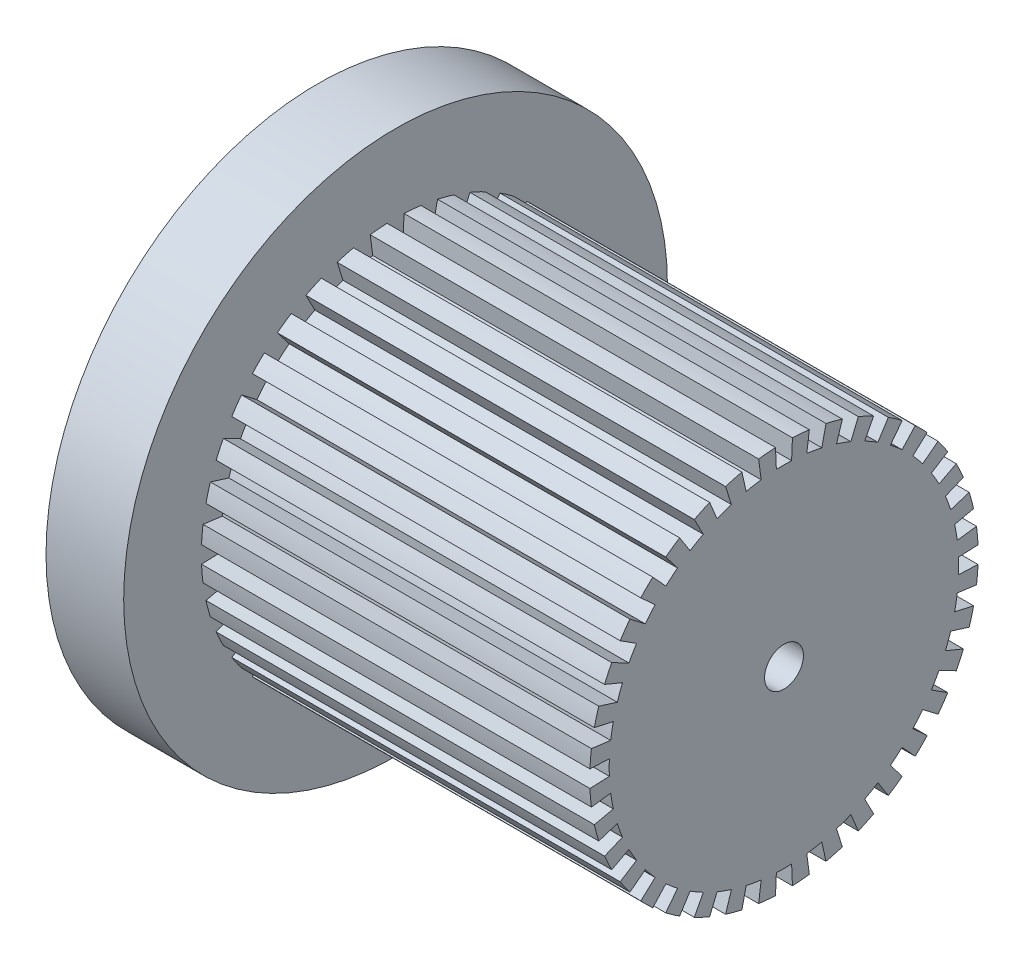
from build123d import *

# Parameters (mm, degrees)
BOSS_EXTRUDE1_DEPTH = 1
SKETCH2_R           = 7
BOSS_EXTRUDE2_DEPTH = 2
BOSS_EXTRUDE3_DEPTH = 10
SKETCH4_R           = 0.5
CUT_EXTRUDE1_DEPTH  = 17.340134638


with BuildPart() as part:
    # Sketch1 → Boss-Extrude1 (new body)
    with BuildSketch(Plane(origin=(0, 0, 0), x_dir=(0, 0, -1), z_dir=(1, 0, 0))):
        with BuildLine():
            Line((0.095962652, 2.197906087), (0.109048468, 2.497620554))
            ThreePointArc((0.109048468, 2.497620554), (0.217889357, 2.490486745), (0.326315481, 2.478612153))
            Line((0.326315481, 2.478612153), (0.287157623, 2.181178695))
            ThreePointArc((0.287157623, 2.181178695), (0.382025991, 2.166577057), (0.476167151, 2.147851216))
            Line((0.476167151, 2.147851216), (0.541099035, 2.440740018))
            ThreePointArc((0.541099035, 2.440740018), (0.647047613, 2.414814566), (0.751764499, 2.384292377))
            Line((0.751764499, 2.384292377), (0.661552759, 2.098177292))
            ThreePointArc((0.661552759, 2.098177292), (0.752444315, 2.067323766), (0.841903551, 2.032534972))
            Line((0.841903551, 2.032534972), (0.956708581, 2.309698831))
            ThreePointArc((0.956708581, 2.309698831), (1.056545654, 2.265769468), (1.154371533, 2.217527083))
            Line((1.154371533, 2.217527083), (1.015846949, 1.951423833))
            ThreePointArc((1.015846949, 1.951423833), (1.1, 1.905255888), (1.182059138, 1.855461181))
            Line((1.182059138, 1.855461181), (1.343249021, 2.108478615))
            ThreePointArc((1.343249021, 2.108478615), (1.433941091, 2.047880111), (1.521903573, 1.983383351))
            Line((1.521903573, 1.983383351), (1.339275144, 1.745377349))
            ThreePointArc((1.339275144, 1.745377349), (1.414132741, 1.685297775), (1.486298457, 1.622010141))
            Line((1.486298457, 1.622010141), (1.688975519, 1.843193342))
            ThreePointArc((1.688975519, 1.843193342), (1.767766953, 1.767766953), (1.843193342, 1.688975519))
            Line((1.843193342, 1.688975519), (1.622010141, 1.486298457))
            ThreePointArc((1.622010141, 1.486298457), (1.685297775, 1.414132741), (1.745377349, 1.339275144))
            Line((1.745377349, 1.339275144), (1.983383351, 1.521903573))
            ThreePointArc((1.983383351, 1.521903573), (2.047880111, 1.433941091), (2.108478615, 1.343249021))
            Line((2.108478615, 1.343249021), (1.855461181, 1.182059138))
            ThreePointArc((1.855461181, 1.182059138), (1.905255888, 1.1), (1.951423833, 1.015846949))
            Line((1.951423833, 1.015846949), (2.217527083, 1.154371533))
            ThreePointArc((2.217527083, 1.154371533), (2.265769468, 1.056545654), (2.309698831, 0.956708581))
            Line((2.309698831, 0.956708581), (2.032534972, 0.841903551))
            ThreePointArc((2.032534972, 0.841903551), (2.067323766, 0.752444315), (2.098177292, 0.661552759))
            Line((2.098177292, 0.661552759), (2.384292377, 0.751764499))
            ThreePointArc((2.384292377, 0.751764499), (2.414814566, 0.647047613), (2.440740018, 0.541099035))
            Line((2.440740018, 0.541099035), (2.147851216, 0.476167151))
            ThreePointArc((2.147851216, 0.476167151), (2.166577057, 0.382025991), (2.181178695, 0.287157623))
            Line((2.181178695, 0.287157623), (2.478612153, 0.326315481))
            ThreePointArc((2.478612153, 0.326315481), (2.490486745, 0.217889357), (2.497620554, 0.109048468))
            Line((2.497620554, 0.109048468), (2.197906087, 0.095962652))
            ThreePointArc((2.197906087, 0.095962652), (2.2, 0), (2.197906087, -0.095962652))
            Line((2.197906087, -0.095962652), (2.497620554, -0.109048468))
            ThreePointArc((2.497620554, -0.109048468), (2.490486745, -0.217889357), (2.478612153, -0.326315481))
            Line((2.478612153, -0.326315481), (2.181178695, -0.287157623))
            ThreePointArc((2.181178695, -0.287157623), (2.166577057, -0.382025991), (2.147851216, -0.476167151))
            Line((2.147851216, -0.476167151), (2.440740018, -0.541099035))
            ThreePointArc((2.440740018, -0.541099035), (2.414814566, -0.647047613), (2.384292377, -0.751764499))
            Line((2.384292377, -0.751764499), (2.098177292, -0.661552759))
            ThreePointArc((2.098177292, -0.661552759), (2.067323766, -0.752444315), (2.032534972, -0.841903551))
            Line((2.032534972, -0.841903551), (2.309698831, -0.956708581))
            ThreePointArc((2.309698831, -0.956708581), (2.265769468, -1.056545654), (2.217527083, -1.154371533))
            Line((2.217527083, -1.154371533), (1.951423833, -1.015846949))
            ThreePointArc((1.951423833, -1.015846949), (1.905255888, -1.1), (1.855461181, -1.182059138))
            Line((1.855461181, -1.182059138), (2.108478615, -1.343249021))
            ThreePointArc((2.108478615, -1.343249021), (2.047880111, -1.433941091), (1.983383351, -1.521903573))
            Line((1.983383351, -1.521903573), (1.745377349, -1.339275144))
            ThreePointArc((1.745377349, -1.339275144), (1.685297775, -1.414132741), (1.622010141, -1.486298457))
            Line((1.622010141, -1.486298457), (1.843193342, -1.688975519))
            ThreePointArc((1.843193342, -1.688975519), (1.767766953, -1.767766953), (1.688975519, -1.843193342))
            Line((1.688975519, -1.843193342), (1.486298457, -1.622010141))
            ThreePointArc((1.486298457, -1.622010141), (1.414132741, -1.685297775), (1.339275144, -1.745377349))
            Line((1.339275144, -1.745377349), (1.521903573, -1.983383351))
            ThreePointArc((1.521903573, -1.983383351), (1.433941091, -2.047880111), (1.343249021, -2.108478615))
            Line((1.343249021, -2.108478615), (1.182059138, -1.855461181))
            ThreePointArc((1.182059138, -1.855461181), (1.1, -1.905255888), (1.015846949, -1.951423833))
            Line((1.015846949, -1.951423833), (1.154371533, -2.217527083))
            ThreePointArc((1.154371533, -2.217527083), (1.056545654, -2.265769468), (0.956708581, -2.309698831))
            Line((0.956708581, -2.309698831), (0.841903551, -2.032534972))
            ThreePointArc((0.841903551, -2.032534972), (0.752444315, -2.067323766), (0.661552759, -2.098177292))
            Line((0.661552759, -2.098177292), (0.751764499, -2.384292377))
            ThreePointArc((0.751764499, -2.384292377), (0.647047613, -2.414814566), (0.541099035, -2.440740018))
            Line((0.541099035, -2.440740018), (0.476167151, -2.147851216))
            ThreePointArc((0.476167151, -2.147851216), (0.382025991, -2.166577057), (0.287157623, -2.181178695))
            Line((0.287157623, -2.181178695), (0.326315481, -2.478612153))
            ThreePointArc((0.326315481, -2.478612153), (0.217889357, -2.490486745), (0.109048468, -2.497620554))
            Line((0.109048468, -2.497620554), (0.095962652, -2.197906087))
            ThreePointArc((0.095962652, -2.197906087), (0, -2.2), (-0.095962652, -2.197906087))
            Line((-0.095962652, -2.197906087), (-0.109048468, -2.497620554))
            ThreePointArc((-0.109048468, -2.497620554), (-0.217889357, -2.490486745), (-0.326315481, -2.478612153))
            Line((-0.326315481, -2.478612153), (-0.287157623, -2.181178695))
            ThreePointArc((-0.287157623, -2.181178695), (-0.382025991, -2.166577057), (-0.476167151, -2.147851216))
            Line((-0.476167151, -2.147851216), (-0.541099035, -2.440740018))
            ThreePointArc((-0.541099035, -2.440740018), (-0.647047613, -2.414814566), (-0.751764499, -2.384292377))
            Line((-0.751764499, -2.384292377), (-0.661552759, -2.098177292))
            ThreePointArc((-0.661552759, -2.098177292), (-0.752444315, -2.067323766), (-0.841903551, -2.032534972))
            Line((-0.841903551, -2.032534972), (-0.956708581, -2.309698831))
            ThreePointArc((-0.956708581, -2.309698831), (-1.056545654, -2.265769468), (-1.154371533, -2.217527083))
            Line((-1.154371533, -2.217527083), (-1.015846949, -1.951423833))
            ThreePointArc((-1.015846949, -1.951423833), (-1.1, -1.905255888), (-1.182059138, -1.855461181))
            Line((-1.182059138, -1.855461181), (-1.343249021, -2.108478615))
            ThreePointArc((-1.343249021, -2.108478615), (-1.433941091, -2.047880111), (-1.521903573, -1.983383351))
            Line((-1.521903573, -1.983383351), (-1.339275144, -1.745377349))
            ThreePointArc((-1.339275144, -1.745377349), (-1.414132741, -1.685297775), (-1.486298457, -1.622010141))
            Line((-1.486298457, -1.622010141), (-1.688975519, -1.843193342))
            ThreePointArc((-1.688975519, -1.843193342), (-1.767766953, -1.767766953), (-1.843193342, -1.688975519))
            Line((-1.843193342, -1.688975519), (-1.622010141, -1.486298457))
            ThreePointArc((-1.622010141, -1.486298457), (-1.685297775, -1.414132741), (-1.745377349, -1.339275144))
            Line((-1.745377349, -1.339275144), (-1.983383351, -1.521903573))
            ThreePointArc((-1.983383351, -1.521903573), (-2.047880111, -1.433941091), (-2.108478615, -1.343249021))
            Line((-2.108478615, -1.343249021), (-1.855461181, -1.182059138))
            ThreePointArc((-1.855461181, -1.182059138), (-1.905255888, -1.1), (-1.951423833, -1.015846949))
            Line((-1.951423833, -1.015846949), (-2.217527083, -1.154371533))
            ThreePointArc((-2.217527083, -1.154371533), (-2.265769468, -1.056545654), (-2.309698831, -0.956708581))
            Line((-2.309698831, -0.956708581), (-2.032534972, -0.841903551))
            ThreePointArc((-2.032534972, -0.841903551), (-2.067323766, -0.752444315), (-2.098177292, -0.661552759))
            Line((-2.098177292, -0.661552759), (-2.384292377, -0.751764499))
            ThreePointArc((-2.384292377, -0.751764499), (-2.414814566, -0.647047613), (-2.440740018, -0.541099035))
            Line((-2.440740018, -0.541099035), (-2.147851216, -0.476167151))
            ThreePointArc((-2.147851216, -0.476167151), (-2.166577057, -0.382025991), (-2.181178695, -0.287157623))
            Line((-2.181178695, -0.287157623), (-2.478612153, -0.326315481))
            ThreePointArc((-2.478612153, -0.326315481), (-2.490486745, -0.217889357), (-2.497620554, -0.109048468))
            Line((-2.497620554, -0.109048468), (-2.197906087, -0.095962652))
            ThreePointArc((-2.197906087, -0.095962652), (-2.2, 0), (-2.197906087, 0.095962652))
            Line((-2.197906087, 0.095962652), (-2.497620554, 0.109048468))
            ThreePointArc((-2.497620554, 0.109048468), (-2.490486745, 0.217889357), (-2.478612153, 0.326315481))
            Line((-2.478612153, 0.326315481), (-2.181178695, 0.287157623))
            ThreePointArc((-2.181178695, 0.287157623), (-2.166577057, 0.382025991), (-2.147851216, 0.476167151))
            Line((-2.147851216, 0.476167151), (-2.440740018, 0.541099035))
            ThreePointArc((-2.440740018, 0.541099035), (-2.414814566, 0.647047613), (-2.384292377, 0.751764499))
            Line((-2.384292377, 0.751764499), (-2.098177292, 0.661552759))
            ThreePointArc((-2.098177292, 0.661552759), (-2.067323766, 0.752444315), (-2.032534972, 0.841903551))
            Line((-2.032534972, 0.841903551), (-2.309698831, 0.956708581))
            ThreePointArc((-2.309698831, 0.956708581), (-2.265769468, 1.056545654), (-2.217527083, 1.154371533))
            Line((-2.217527083, 1.154371533), (-1.951423833, 1.015846949))
            ThreePointArc((-1.951423833, 1.015846949), (-1.905255888, 1.1), (-1.855461181, 1.182059138))
            Line((-1.855461181, 1.182059138), (-2.108478615, 1.343249021))
            ThreePointArc((-2.108478615, 1.343249021), (-2.047880111, 1.433941091), (-1.983383351, 1.521903573))
            Line((-1.983383351, 1.521903573), (-1.745377349, 1.339275144))
            ThreePointArc((-1.745377349, 1.339275144), (-1.685297775, 1.414132741), (-1.622010141, 1.486298457))
            Line((-1.622010141, 1.486298457), (-1.843193342, 1.688975519))
            ThreePointArc((-1.843193342, 1.688975519), (-1.767766953, 1.767766953), (-1.688975519, 1.843193342))
            Line((-1.688975519, 1.843193342), (-1.486298457, 1.622010141))
            ThreePointArc((-1.486298457, 1.622010141), (-1.414132741, 1.685297775), (-1.339275144, 1.745377349))
            Line((-1.339275144, 1.745377349), (-1.521903573, 1.983383351))
            ThreePointArc((-1.521903573, 1.983383351), (-1.433941091, 2.047880111), (-1.343249021, 2.108478615))
            Line((-1.343249021, 2.108478615), (-1.182059138, 1.855461181))
            ThreePointArc((-1.182059138, 1.855461181), (-1.1, 1.905255888), (-1.015846949, 1.951423833))
            Line((-1.015846949, 1.951423833), (-1.154371533, 2.217527083))
            ThreePointArc((-1.154371533, 2.217527083), (-1.056545654, 2.265769468), (-0.956708581, 2.309698831))
            Line((-0.956708581, 2.309698831), (-0.841903551, 2.032534972))
            ThreePointArc((-0.841903551, 2.032534972), (-0.752444315, 2.067323766), (-0.661552759, 2.098177292))
            Line((-0.661552759, 2.098177292), (-0.751764499, 2.384292377))
            ThreePointArc((-0.751764499, 2.384292377), (-0.647047613, 2.414814566), (-0.541099035, 2.440740018))
            Line((-0.541099035, 2.440740018), (-0.476167151, 2.147851216))
            ThreePointArc((-0.476167151, 2.147851216), (-0.382025991, 2.166577057), (-0.287157623, 2.181178695))
            Line((-0.287157623, 2.181178695), (-0.326315481, 2.478612153))
            ThreePointArc((-0.326315481, 2.478612153), (-0.217889357, 2.490486745), (-0.109048468, 2.497620554))
            Line((-0.109048468, 2.497620554), (-0.095962652, 2.197906087))
            ThreePointArc((-0.095962652, 2.197906087), (0, 2.2), (0.095962652, 2.197906087))
        make_face()
    extrude(amount=BOSS_EXTRUDE1_DEPTH)

    # Sketch2 → Boss-Extrude2 (add)
    with BuildSketch(Plane(origin=(1, 0, 0), x_dir=(0, 0, -1), z_dir=(1, 0, 0))):
        Circle(SKETCH2_R)
    extrude(amount=BOSS_EXTRUDE2_DEPTH)

    # Sketch3 → Boss-Extrude3 (add)
    with BuildSketch(Plane(origin=(3, 0, 0), x_dir=(0, 0, -1), z_dir=(1, 0, 0))):
        with BuildLine():
            Line((0.196287243, 4.495716997), (0.218096937, 4.995241108))
            ThreePointArc((0.218096937, 4.995241108), (0.435778714, 4.98097349), (0.652630961, 4.957224307))
            Line((0.652630961, 4.957224307), (0.587367865, 4.461501876))
            ThreePointArc((0.587367865, 4.461501876), (0.7814168, 4.431634889), (0.973978263, 4.393332032))
            Line((0.973978263, 4.393332032), (1.08219807, 4.881480036))
            ThreePointArc((1.08219807, 4.881480036), (1.294095226, 4.829629131), (1.503528998, 4.768584754))
            Line((1.503528998, 4.768584754), (1.353176098, 4.291726278))
            ThreePointArc((1.353176098, 4.291726278), (1.539090645, 4.228616794), (1.722075446, 4.157457896))
            Line((1.722075446, 4.157457896), (1.913417162, 4.619397663))
            ThreePointArc((1.913417162, 4.619397663), (2.113091309, 4.531538935), (2.308743066, 4.435054166))
            Line((2.308743066, 4.435054166), (2.07786876, 3.991548749))
            ThreePointArc((2.07786876, 3.991548749), (2.25, 3.897114317), (2.417848238, 3.795261506))
            Line((2.417848238, 3.795261506), (2.686498042, 4.216957229))
            ThreePointArc((2.686498042, 4.216957229), (2.867882182, 4.095760221), (3.043807145, 3.966766701))
            Line((3.043807145, 3.966766701), (2.739426431, 3.570090031))
            ThreePointArc((2.739426431, 3.570090031), (2.892544244, 3.447199994), (3.040155934, 3.317748016))
            Line((3.040155934, 3.317748016), (3.377951038, 3.686386684))
            ThreePointArc((3.377951038, 3.686386684), (3.535533906, 3.535533906), (3.686386684, 3.377951038))
            Line((3.686386684, 3.377951038), (3.317748016, 3.040155934))
            ThreePointArc((3.317748016, 3.040155934), (3.447199994, 2.892544244), (3.570090031, 2.739426431))
            Line((3.570090031, 2.739426431), (3.966766701, 3.043807145))
            ThreePointArc((3.966766701, 3.043807145), (4.095760221, 2.867882182), (4.216957229, 2.686498042))
            Line((4.216957229, 2.686498042), (3.795261506, 2.417848238))
            ThreePointArc((3.795261506, 2.417848238), (3.897114317, 2.25), (3.991548749, 2.07786876))
            Line((3.991548749, 2.07786876), (4.435054166, 2.308743066))
            ThreePointArc((4.435054166, 2.308743066), (4.531538935, 2.113091309), (4.619397663, 1.913417162))
            Line((4.619397663, 1.913417162), (4.157457896, 1.722075446))
            ThreePointArc((4.157457896, 1.722075446), (4.228616794, 1.539090645), (4.291726278, 1.353176098))
            Line((4.291726278, 1.353176098), (4.768584754, 1.503528998))
            ThreePointArc((4.768584754, 1.503528998), (4.829629131, 1.294095226), (4.881480036, 1.08219807))
            Line((4.881480036, 1.08219807), (4.393332032, 0.973978263))
            ThreePointArc((4.393332032, 0.973978263), (4.431634889, 0.7814168), (4.461501876, 0.587367865))
            Line((4.461501876, 0.587367865), (4.957224307, 0.652630961))
            ThreePointArc((4.957224307, 0.652630961), (4.98097349, 0.435778714), (4.995241108, 0.218096937))
            Line((4.995241108, 0.218096937), (4.495716997, 0.196287243))
            ThreePointArc((4.495716997, 0.196287243), (4.5, 0), (4.495716997, -0.196287243))
            Line((4.495716997, -0.196287243), (4.995241108, -0.218096937))
            ThreePointArc((4.995241108, -0.218096937), (4.98097349, -0.435778714), (4.957224307, -0.652630961))
            Line((4.957224307, -0.652630961), (4.461501876, -0.587367865))
            ThreePointArc((4.461501876, -0.587367865), (4.431634889, -0.7814168), (4.393332032, -0.973978263))
            Line((4.393332032, -0.973978263), (4.881480036, -1.08219807))
            ThreePointArc((4.881480036, -1.08219807), (4.829629131, -1.294095226), (4.768584754, -1.503528998))
            Line((4.768584754, -1.503528998), (4.291726278, -1.353176098))
            ThreePointArc((4.291726278, -1.353176098), (4.228616794, -1.539090645), (4.157457896, -1.722075446))
            Line((4.157457896, -1.722075446), (4.619397663, -1.913417162))
            ThreePointArc((4.619397663, -1.913417162), (4.531538935, -2.113091309), (4.435054166, -2.308743066))
            Line((4.435054166, -2.308743066), (3.991548749, -2.07786876))
            ThreePointArc((3.991548749, -2.07786876), (3.897114317, -2.25), (3.795261506, -2.417848238))
            Line((3.795261506, -2.417848238), (4.216957229, -2.686498042))
            ThreePointArc((4.216957229, -2.686498042), (4.095760221, -2.867882182), (3.966766701, -3.043807145))
            Line((3.966766701, -3.043807145), (3.570090031, -2.739426431))
            ThreePointArc((3.570090031, -2.739426431), (3.447199994, -2.892544244), (3.317748016, -3.040155934))
            Line((3.317748016, -3.040155934), (3.686386684, -3.377951038))
            ThreePointArc((3.686386684, -3.377951038), (3.535533906, -3.535533906), (3.377951038, -3.686386684))
            Line((3.377951038, -3.686386684), (3.040155934, -3.317748016))
            ThreePointArc((3.040155934, -3.317748016), (2.892544244, -3.447199994), (2.739426431, -3.570090031))
            Line((2.739426431, -3.570090031), (3.043807145, -3.966766701))
            ThreePointArc((3.043807145, -3.966766701), (2.867882182, -4.095760221), (2.686498042, -4.216957229))
            Line((2.686498042, -4.216957229), (2.417848238, -3.795261506))
            ThreePointArc((2.417848238, -3.795261506), (2.25, -3.897114317), (2.07786876, -3.991548749))
            Line((2.07786876, -3.991548749), (2.308743066, -4.435054166))
            ThreePointArc((2.308743066, -4.435054166), (2.113091309, -4.531538935), (1.913417162, -4.619397663))
            Line((1.913417162, -4.619397663), (1.722075446, -4.157457896))
            ThreePointArc((1.722075446, -4.157457896), (1.539090645, -4.228616794), (1.353176098, -4.291726278))
            Line((1.353176098, -4.291726278), (1.503528998, -4.768584754))
            ThreePointArc((1.503528998, -4.768584754), (1.294095226, -4.829629131), (1.08219807, -4.881480036))
            Line((1.08219807, -4.881480036), (0.973978263, -4.393332032))
            ThreePointArc((0.973978263, -4.393332032), (0.7814168, -4.431634889), (0.587367865, -4.461501876))
            Line((0.587367865, -4.461501876), (0.652630961, -4.957224307))
            ThreePointArc((0.652630961, -4.957224307), (0.435778714, -4.98097349), (0.218096937, -4.995241108))
            Line((0.218096937, -4.995241108), (0.196287243, -4.495716997))
            ThreePointArc((0.196287243, -4.495716997), (0, -4.5), (-0.196287243, -4.495716997))
            Line((-0.196287243, -4.495716997), (-0.218096937, -4.995241108))
            ThreePointArc((-0.218096937, -4.995241108), (-0.435778714, -4.98097349), (-0.652630961, -4.957224307))
            Line((-0.652630961, -4.957224307), (-0.587367865, -4.461501876))
            ThreePointArc((-0.587367865, -4.461501876), (-0.7814168, -4.431634889), (-0.973978263, -4.393332032))
            Line((-0.973978263, -4.393332032), (-1.08219807, -4.881480036))
            ThreePointArc((-1.08219807, -4.881480036), (-1.294095226, -4.829629131), (-1.503528998, -4.768584754))
            Line((-1.503528998, -4.768584754), (-1.353176098, -4.291726278))
            ThreePointArc((-1.353176098, -4.291726278), (-1.539090645, -4.228616794), (-1.722075446, -4.157457896))
            Line((-1.722075446, -4.157457896), (-1.913417162, -4.619397663))
            ThreePointArc((-1.913417162, -4.619397663), (-2.113091309, -4.531538935), (-2.308743066, -4.435054166))
            Line((-2.308743066, -4.435054166), (-2.07786876, -3.991548749))
            ThreePointArc((-2.07786876, -3.991548749), (-2.25, -3.897114317), (-2.417848238, -3.795261506))
            Line((-2.417848238, -3.795261506), (-2.686498042, -4.216957229))
            ThreePointArc((-2.686498042, -4.216957229), (-2.867882182, -4.095760221), (-3.043807145, -3.966766701))
            Line((-3.043807145, -3.966766701), (-2.739426431, -3.570090031))
            ThreePointArc((-2.739426431, -3.570090031), (-2.892544244, -3.447199994), (-3.040155934, -3.317748016))
            Line((-3.040155934, -3.317748016), (-3.377951038, -3.686386684))
            ThreePointArc((-3.377951038, -3.686386684), (-3.535533906, -3.535533906), (-3.686386684, -3.377951038))
            Line((-3.686386684, -3.377951038), (-3.317748016, -3.040155934))
            ThreePointArc((-3.317748016, -3.040155934), (-3.447199994, -2.892544244), (-3.570090031, -2.739426431))
            Line((-3.570090031, -2.739426431), (-3.966766701, -3.043807145))
            ThreePointArc((-3.966766701, -3.043807145), (-4.095760221, -2.867882182), (-4.216957229, -2.686498042))
            Line((-4.216957229, -2.686498042), (-3.795261506, -2.417848238))
            ThreePointArc((-3.795261506, -2.417848238), (-3.897114317, -2.25), (-3.991548749, -2.07786876))
            Line((-3.991548749, -2.07786876), (-4.435054166, -2.308743066))
            ThreePointArc((-4.435054166, -2.308743066), (-4.531538935, -2.113091309), (-4.619397663, -1.913417162))
            Line((-4.619397663, -1.913417162), (-4.157457896, -1.722075446))
            ThreePointArc((-4.157457896, -1.722075446), (-4.228616794, -1.539090645), (-4.291726278, -1.353176098))
            Line((-4.291726278, -1.353176098), (-4.768584754, -1.503528998))
            ThreePointArc((-4.768584754, -1.503528998), (-4.829629131, -1.294095226), (-4.881480036, -1.08219807))
            Line((-4.881480036, -1.08219807), (-4.393332032, -0.973978263))
            ThreePointArc((-4.393332032, -0.973978263), (-4.431634889, -0.7814168), (-4.461501876, -0.587367865))
            Line((-4.461501876, -0.587367865), (-4.957224307, -0.652630961))
            ThreePointArc((-4.957224307, -0.652630961), (-4.98097349, -0.435778714), (-4.995241108, -0.218096937))
            Line((-4.995241108, -0.218096937), (-4.495716997, -0.196287243))
            ThreePointArc((-4.495716997, -0.196287243), (-4.5, 0), (-4.495716997, 0.196287243))
            Line((-4.495716997, 0.196287243), (-4.995241108, 0.218096937))
            ThreePointArc((-4.995241108, 0.218096937), (-4.98097349, 0.435778714), (-4.957224307, 0.652630961))
            Line((-4.957224307, 0.652630961), (-4.461501876, 0.587367865))
            ThreePointArc((-4.461501876, 0.587367865), (-4.431634889, 0.7814168), (-4.393332032, 0.973978263))
            Line((-4.393332032, 0.973978263), (-4.881480036, 1.08219807))
            ThreePointArc((-4.881480036, 1.08219807), (-4.829629131, 1.294095226), (-4.768584754, 1.503528998))
            Line((-4.768584754, 1.503528998), (-4.291726278, 1.353176098))
            ThreePointArc((-4.291726278, 1.353176098), (-4.228616794, 1.539090645), (-4.157457896, 1.722075446))
            Line((-4.157457896, 1.722075446), (-4.619397663, 1.913417162))
            ThreePointArc((-4.619397663, 1.913417162), (-4.531538935, 2.113091309), (-4.435054166, 2.308743066))
            Line((-4.435054166, 2.308743066), (-3.991548749, 2.07786876))
            ThreePointArc((-3.991548749, 2.07786876), (-3.897114317, 2.25), (-3.795261506, 2.417848238))
            Line((-3.795261506, 2.417848238), (-4.216957229, 2.686498042))
            ThreePointArc((-4.216957229, 2.686498042), (-4.095760221, 2.867882182), (-3.966766701, 3.043807145))
            Line((-3.966766701, 3.043807145), (-3.570090031, 2.739426431))
            ThreePointArc((-3.570090031, 2.739426431), (-3.447199994, 2.892544244), (-3.317748016, 3.040155934))
            Line((-3.317748016, 3.040155934), (-3.686386684, 3.377951038))
            ThreePointArc((-3.686386684, 3.377951038), (-3.535533906, 3.535533906), (-3.377951038, 3.686386684))
            Line((-3.377951038, 3.686386684), (-3.040155934, 3.317748016))
            ThreePointArc((-3.040155934, 3.317748016), (-2.892544244, 3.447199994), (-2.739426431, 3.570090031))
            Line((-2.739426431, 3.570090031), (-3.043807145, 3.966766701))
            ThreePointArc((-3.043807145, 3.966766701), (-2.867882182, 4.095760221), (-2.686498042, 4.216957229))
            Line((-2.686498042, 4.216957229), (-2.417848238, 3.795261506))
            ThreePointArc((-2.417848238, 3.795261506), (-2.25, 3.897114317), (-2.07786876, 3.991548749))
            Line((-2.07786876, 3.991548749), (-2.308743066, 4.435054166))
            ThreePointArc((-2.308743066, 4.435054166), (-2.113091309, 4.531538935), (-1.913417162, 4.619397663))
            Line((-1.913417162, 4.619397663), (-1.722075446, 4.157457896))
            ThreePointArc((-1.722075446, 4.157457896), (-1.539090645, 4.228616794), (-1.353176098, 4.291726278))
            Line((-1.353176098, 4.291726278), (-1.503528998, 4.768584754))
            ThreePointArc((-1.503528998, 4.768584754), (-1.294095226, 4.829629131), (-1.08219807, 4.881480036))
            Line((-1.08219807, 4.881480036), (-0.973978263, 4.393332032))
            ThreePointArc((-0.973978263, 4.393332032), (-0.7814168, 4.431634889), (-0.587367865, 4.461501876))
            Line((-0.587367865, 4.461501876), (-0.652630961, 4.957224307))
            ThreePointArc((-0.652630961, 4.957224307), (-0.435778714, 4.98097349), (-0.218096937, 4.995241108))
            Line((-0.218096937, 4.995241108), (-0.196287243, 4.495716997))
            ThreePointArc((-0.196287243, 4.495716997), (0, 4.5), (0.196287243, 4.495716997))
        make_face()
    extrude(amount=BOSS_EXTRUDE3_DEPTH)

    # Sketch4 → Cut-Extrude1 (cut, through all)
    with BuildSketch(Plane(origin=(13, 0, 0), x_dir=(0, 0, -1), z_dir=(1, 0, 0))):
        Circle(SKETCH4_R)
    extrude(amount=-CUT_EXTRUDE1_DEPTH, mode=Mode.SUBTRACT)


solid = part.part
